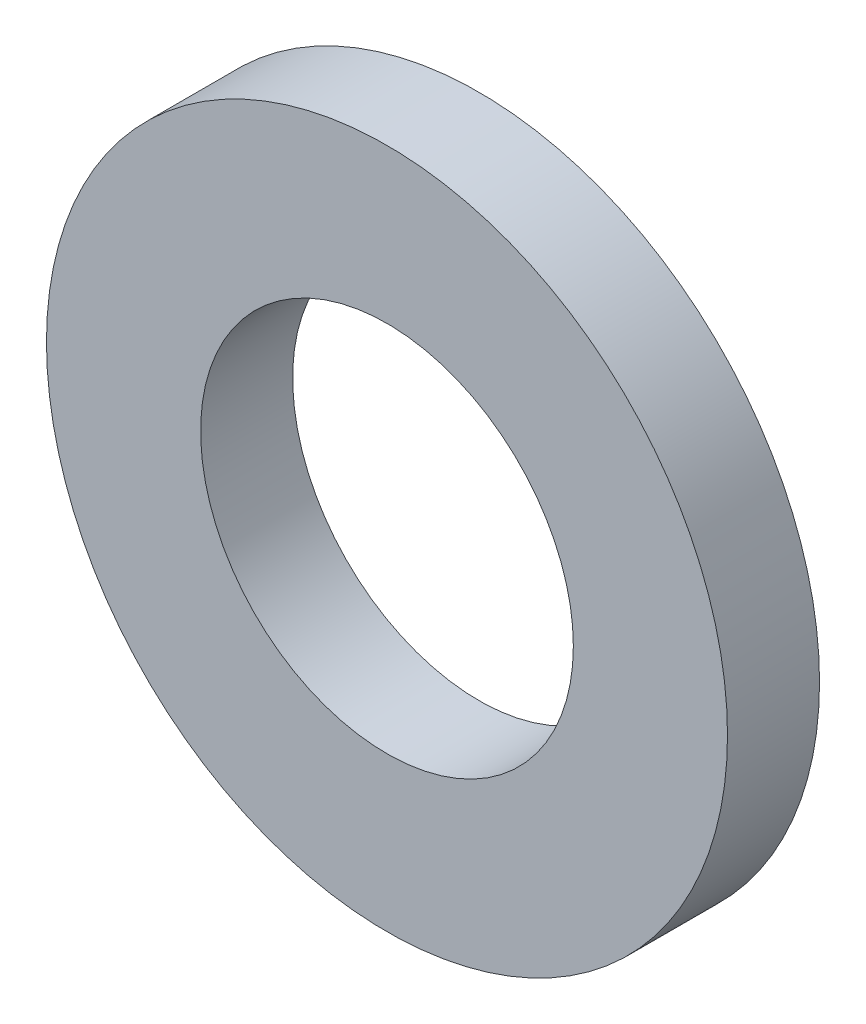
from build123d import *

# Parameters (mm, degrees)
SKETCH_1_R      = 7.4
SKETCH_1_R_2    = 4.05
EXTRUDE_1_DEPTH = 2


with BuildPart() as part:
    # Эскиз1 → Бобышка-Вытянуть1 (new body)
    with BuildSketch(Plane.XY):
        Circle(SKETCH_1_R)
        Circle(SKETCH_1_R_2, mode=Mode.SUBTRACT)
    extrude(amount=EXTRUDE_1_DEPTH)


solid = part.part
